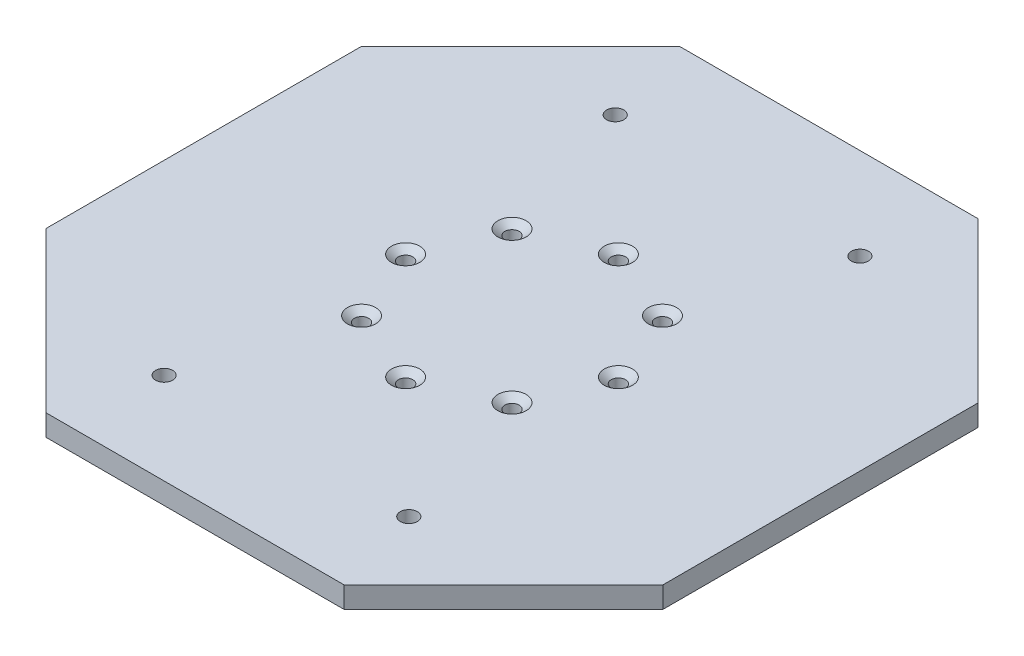
from build123d import *

# Parameters (mm, degrees)
BOSS_EXTRUDE1_DEPTH                               = 6.35
F_7_0_201_DIAMETER_HOLE1_D                        = 5.1054
CIRPATTERN1_COUNT                                 = 2
CSK_FOR_8_FLAT_HEAD_MACHINE_SCREW_100_D           = 4.3053
CSK_FOR_8_FLAT_HEAD_MACHINE_SCREW_100_CSINK_D     = 8.4328
CSK_FOR_8_FLAT_HEAD_MACHINE_SCREW_100_CSINK_ANGLE = 100
CIRPATTERN2_COUNT                                 = 8


with BuildPart() as part:
    # Sketch1 → Boss-Extrude1 (new body)
    with BuildSketch(Plane(origin=(0, 0, 0), x_dir=(1, 0, 0), z_dir=(0, 1, 0))):
        Polygon((-92.075, 46.99), (-44.45, 94.615), (44.45, 94.615), (92.075, 46.99), (92.075, -46.99), (44.45, -94.615), (-44.45, -94.615), (-92.075, -46.99), align=None)
    extrude(amount=BOSS_EXTRUDE1_DEPTH)

    # #7 (0.201) Diameter Hole1 (through all)
    with Locations(Plane(origin=(0, 6.35, 0), x_dir=(-1, 0, 0), z_dir=(0, 1, 0))):
        with Locations((36.5125, -67.31), (-36.5125, -67.31)):
            f_7_0_201_diameter_hole1 = Hole(F_7_0_201_DIAMETER_HOLE1_D / 2)

    # CirPattern1: #7 (0.201) Diameter Hole1 ×2 about axis
    cirpattern1_axis = Axis((0, 0, 0), (0, 1, 0))
    for i in range(1, CIRPATTERN1_COUNT):
        add(f_7_0_201_diameter_hole1.rotate(cirpattern1_axis, i * 360 / CIRPATTERN1_COUNT), mode=Mode.SUBTRACT)

    # CSK for #8 Flat Head Machine Screw (100)1 (through all)
    with Locations(Plane(origin=(0, 6.35, 0), x_dir=(-1, 0, 0), z_dir=(0, 1, 0))):
        with Locations((0, 31.75)):
            csk_for_8_flat_head_machine_screw_100 = CounterSinkHole(CSK_FOR_8_FLAT_HEAD_MACHINE_SCREW_100_D / 2, CSK_FOR_8_FLAT_HEAD_MACHINE_SCREW_100_CSINK_D / 2, counter_sink_angle=CSK_FOR_8_FLAT_HEAD_MACHINE_SCREW_100_CSINK_ANGLE)

    # CirPattern2: CSK for #8 Flat Head Machine Screw (100)1 ×8 about axis
    cirpattern2_axis = Axis((0, 0, 0), (0, 1, 0))
    for i in range(1, CIRPATTERN2_COUNT):
        add(csk_for_8_flat_head_machine_screw_100.rotate(cirpattern2_axis, i * 360 / CIRPATTERN2_COUNT), mode=Mode.SUBTRACT)


solid = part.part
